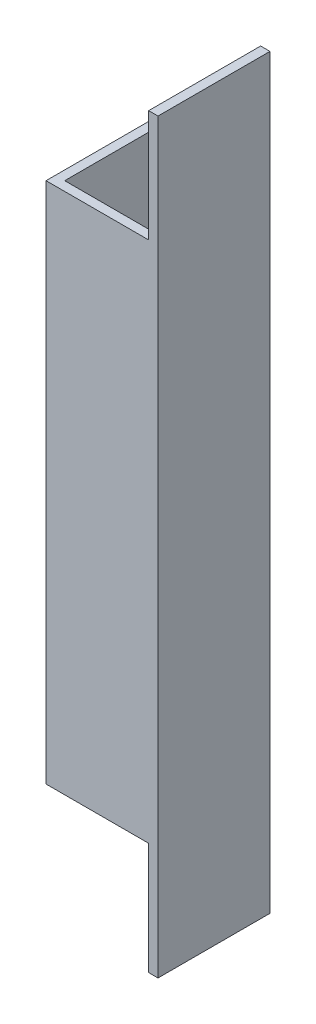
from build123d import *

# Parameters (mm, degrees)
SKETCH1_W           = 19.05
SKETCH1_H           = 19.05
SKETCH1_W_2         = 15.875
SKETCH1_H_2         = 15.875
EXTRUDE_THIN1_DEPTH = 127
SKETCH2_W           = 19.05
SKETCH2_H           = 19.05
CUT_EXTRUDE1_DEPTH  = 17.4625
SKETCH3_W           = 19.05
SKETCH3_H           = 19.05
CUT_EXTRUDE2_DEPTH  = 17.4625


with BuildPart() as part:
    # Sketch1 → Extrude-Thin1 (new body)
    with BuildSketch(Plane(origin=(0, 0, 0), x_dir=(1, 0, 0), z_dir=(0, 1, 0))):
        with Locations((9.525, 9.525)):
            Rectangle(SKETCH1_W, SKETCH1_H)
        with Locations((9.525, 9.525)):
            Rectangle(SKETCH1_W_2, SKETCH1_H_2, mode=Mode.SUBTRACT)
    extrude(amount=EXTRUDE_THIN1_DEPTH)

    # Sketch2 → Cut-Extrude1 (cut)
    with BuildSketch(Plane.ZY):
        with Locations((-9.525, 9.525)):
            Rectangle(SKETCH2_W, SKETCH2_H)
    extrude(amount=-CUT_EXTRUDE1_DEPTH, mode=Mode.SUBTRACT)

    # Sketch3 → Cut-Extrude2 (cut)
    with BuildSketch(Plane.ZY):
        with Locations((-9.525, 117.475)):
            Rectangle(SKETCH3_W, SKETCH3_H)
    extrude(amount=-CUT_EXTRUDE2_DEPTH, mode=Mode.SUBTRACT)


solid = part.part
